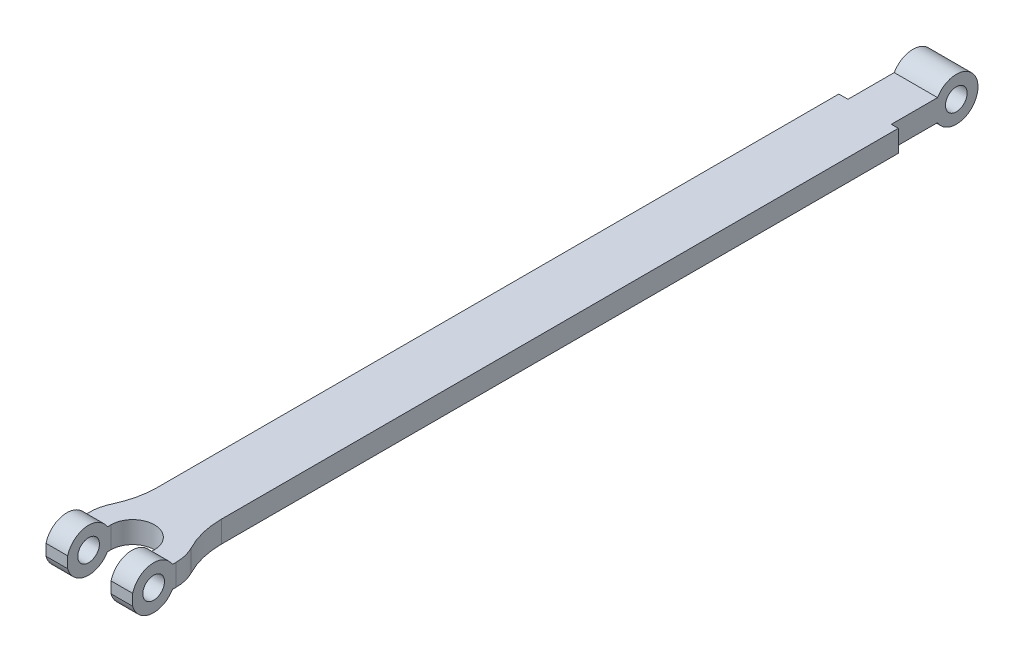
from build123d import *

# Parameters (mm, degrees)
BOSS_EXTRUDE2_DEPTH = 10
SKETCH7_R           = 2.5
CUT_EXTRUDE1_DEPTH  = 142.937027035


with BuildPart() as part:
    # Sketch3 → Boss-Extrude2 (new body)
    with BuildSketch(Plane(origin=(0, 0, 0), x_dir=(1, 0, 0), z_dir=(0, 1, 0))):
        with BuildLine():
            ThreePointArc((-5, -49.835383767), (-3.535533906, -46.299849861), (0, -44.835383767))
            ThreePointArc((0, -44.835383767), (3.535533906, -46.299849861), (5, -49.835383767))
            Line((5, -49.835383767), (5, -59.835383767))
            Line((5, -59.835383767), (10, -59.835383767))
            Line((10, -59.835383767), (10, -49.835383767))
            ThreePointArc((10, -49.835383767), (9.713312199, -47.45808149), (8.869686776, -45.217087925))
            ThreePointArc((8.869686776, -45.217087925), (7.18243593, -40.735100795), (6.609060329, -35.98049624))
            Line((6.609060329, -35.98049624), (6.609060329, 120.164616233))
            Line((6.609060329, 120.164616233), (5, 120.164616233))
            Line((5, 120.164616233), (5, 140.164616233))
            Line((5, 140.164616233), (-5, 140.164616233))
            Line((-5, 140.164616233), (-5, 120.164616233))
            Line((-5, 120.164616233), (-7.105716065, 120.164616233))
            Line((-7.105716065, 120.164616233), (-7.105716065, -36.979250733))
            ThreePointArc((-7.105716065, -36.979250733), (-7.594058684, -41.37188391), (-9.035238688, -45.550006089))
            ThreePointArc((-9.035238688, -45.550006089), (-9.755828695, -47.6390672), (-10, -49.835383811))
            Line((-10, -49.835383811), (-10, -59.835383767))
            Line((-10, -59.835383767), (-5, -59.835383767))
            Line((-5, -59.835383767), (-5, -49.835383767))
        make_face()
    extrude(amount=BOSS_EXTRUDE2_DEPTH)

    # Sketch7 → Cut-Extrude1 (cut, through all)
    with BuildSketch(Plane.ZY.offset(10)):
        with BuildLine():
            ThreePointArc((-140.164616233, 5), (-138.700150139, 8.535533906), (-135.164616233, 10))
            Line((-135.164616233, 10), (-140.164616233, 10))
            Line((-140.164616233, 10), (-140.164616233, 5))
        make_face()
        with BuildLine():
            ThreePointArc((-135.164616202, 0), (-138.700150128, 1.464466083), (-140.164616233, 5))
            Line((-140.164616233, 5), (-140.164616233, 0))
            Line((-140.164616233, 0), (-135.164616202, 0))
        make_face()
        with BuildLine():
            ThreePointArc((-135.164616233, 10), (-132.664616233, 9.330127019), (-130.834489214, 7.5))
            Line((-130.834489214, 7.5), (-120.164616233, 7.5))
            Line((-120.164616233, 7.5), (-120.164616233, 10))
            Line((-120.164616233, 10), (-135.164616233, 10))
        make_face()
        with BuildLine():
            Line((-120.164616233, 0), (-120.164616233, 2.5))
            Line((-120.164616233, 2.5), (-130.834489214, 2.5))
            ThreePointArc((-130.834489214, 2.5), (-132.664616219, 0.669872989), (-135.164616202, 0))
            Line((-135.164616202, 0), (-120.164616233, 0))
        make_face()
        Polygon((49.835383767, 2.5), (-120.164616233, 2.5), (-120.164616233, 0), (36.979250733, 0), (45.550006089, 0), (49.835383767, 0), align=None)
        Polygon((-120.164616233, 10), (-120.164616233, 7.5), (49.835383767, 7.5), (49.835383767, 10), (45.550006089, 10), (36.979250733, 10), align=None)
        with BuildLine():
            Line((49.835383767, 10), (49.835383767, 7.5))
            Line((49.835383767, 7.5), (50.675374481, 7.5))
            ThreePointArc((50.675374481, 7.5), (52.5055015, 9.330127019), (55.0055015, 10))
            Line((55.0055015, 10), (49.835383767, 10))
        make_face()
        with BuildLine():
            Line((59.835383767, 10), (55.0055015, 10))
            ThreePointArc((55.0055015, 10), (58.049696739, 8.966468877), (59.835383767, 6.293150141))
            Line((59.835383767, 6.293150141), (59.835383767, 10))
        make_face()
        with BuildLine():
            ThreePointArc((59.835383767, 3.706849859), (58.049696739, 1.033531123), (55.0055015, 0))
            Line((55.0055015, 0), (59.835383767, 0))
            Line((59.835383767, 0), (59.835383767, 3.706849859))
        make_face()
        with BuildLine():
            Line((50.675374481, 2.5), (49.835383767, 2.5))
            Line((49.835383767, 2.5), (49.835383767, 0))
            Line((49.835383767, 0), (55.0055015, 0))
            ThreePointArc((55.0055015, 0), (52.5055015, 0.669872981), (50.675374481, 2.5))
        make_face()
        with Locations((55.0055015, 5)):
            Circle(SKETCH7_R)
        with Locations((-135.164616233, 5)):
            Circle(SKETCH7_R)
    extrude(amount=-CUT_EXTRUDE1_DEPTH, mode=Mode.SUBTRACT)


solid = part.part
